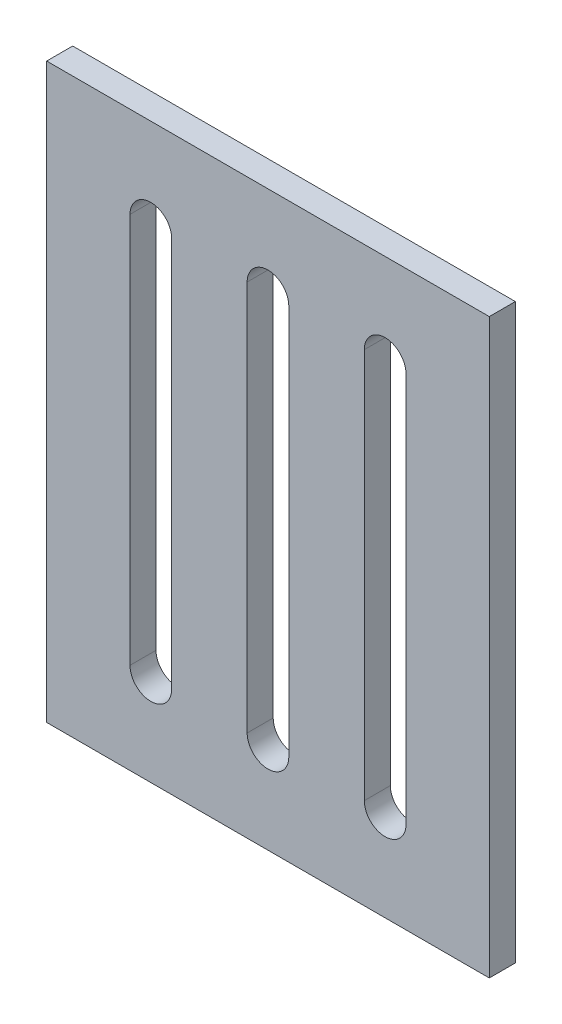
from build123d import *

# Parameters (mm, degrees)
SKETCH3_W           = 170
SKETCH3_H           = 220
BOSS_EXTRUDE1_DEPTH = 5


with BuildPart() as part:
    # Sketch3 → Boss-Extrude1 (new, symmetric)
    with BuildSketch(Plane.XY):
        Rectangle(SKETCH3_W, SKETCH3_H)
        with BuildLine():
            Line((8, 75), (8, -75))
            ThreePointArc((8, -75), (0, -83), (-8, -75))
            Line((-8, -75), (-8, 75))
            ThreePointArc((-8, 75), (0, 83), (8, 75))
        make_face(mode=Mode.SUBTRACT)
        with BuildLine():
            Line((-37, 75), (-37, -75))
            ThreePointArc((-37, -75), (-45, -83), (-53, -75))
            Line((-53, -75), (-53, 75))
            ThreePointArc((-53, 75), (-45, 83), (-37, 75))
        make_face(mode=Mode.SUBTRACT)
        with BuildLine():
            Line((37, 75), (37, -75))
            ThreePointArc((37, -75), (45, -83), (53, -75))
            Line((53, -75), (53, 75))
            ThreePointArc((53, 75), (45, 83), (37, 75))
        make_face(mode=Mode.SUBTRACT)
    extrude(amount=BOSS_EXTRUDE1_DEPTH, both=True)


solid = part.part
